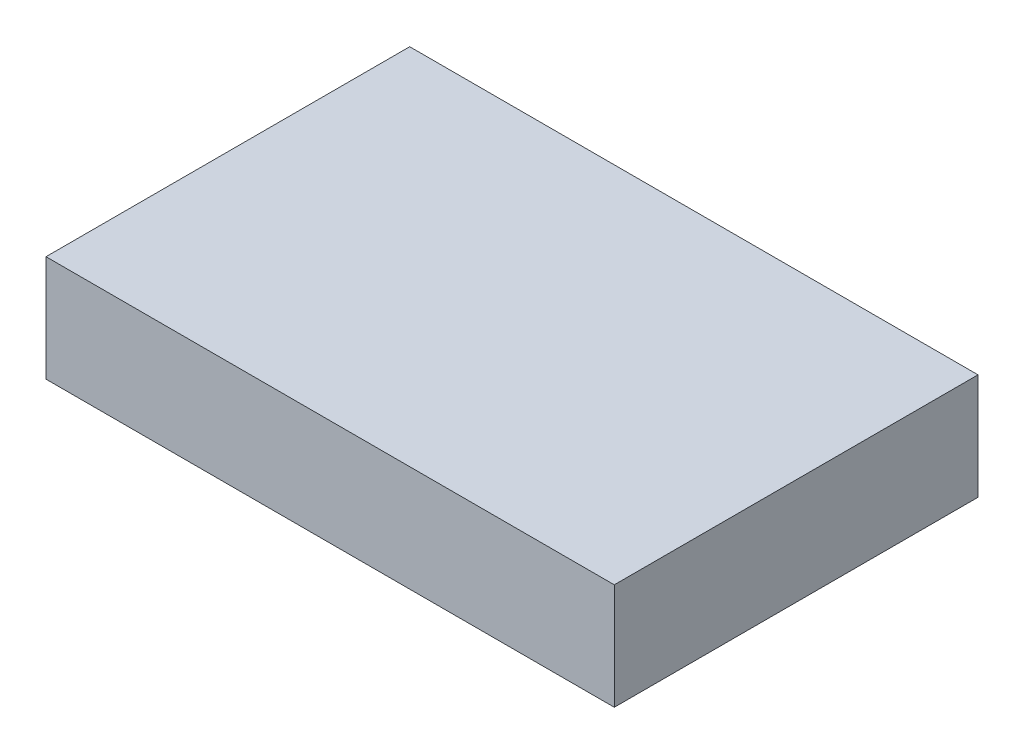
from build123d import *

# Parameters (mm, degrees)
SKETCH1_W           = 75
SKETCH1_H           = 48
BOSS_EXTRUDE1_DEPTH = 14


with BuildPart() as part:
    # Sketch1 → Boss-Extrude1 (new body)
    with BuildSketch(Plane(origin=(0, 0, 0), x_dir=(1, 0, 0), z_dir=(0, 1, 0))):
        Rectangle(SKETCH1_W, SKETCH1_H)
    extrude(amount=BOSS_EXTRUDE1_DEPTH)


solid = part.part
